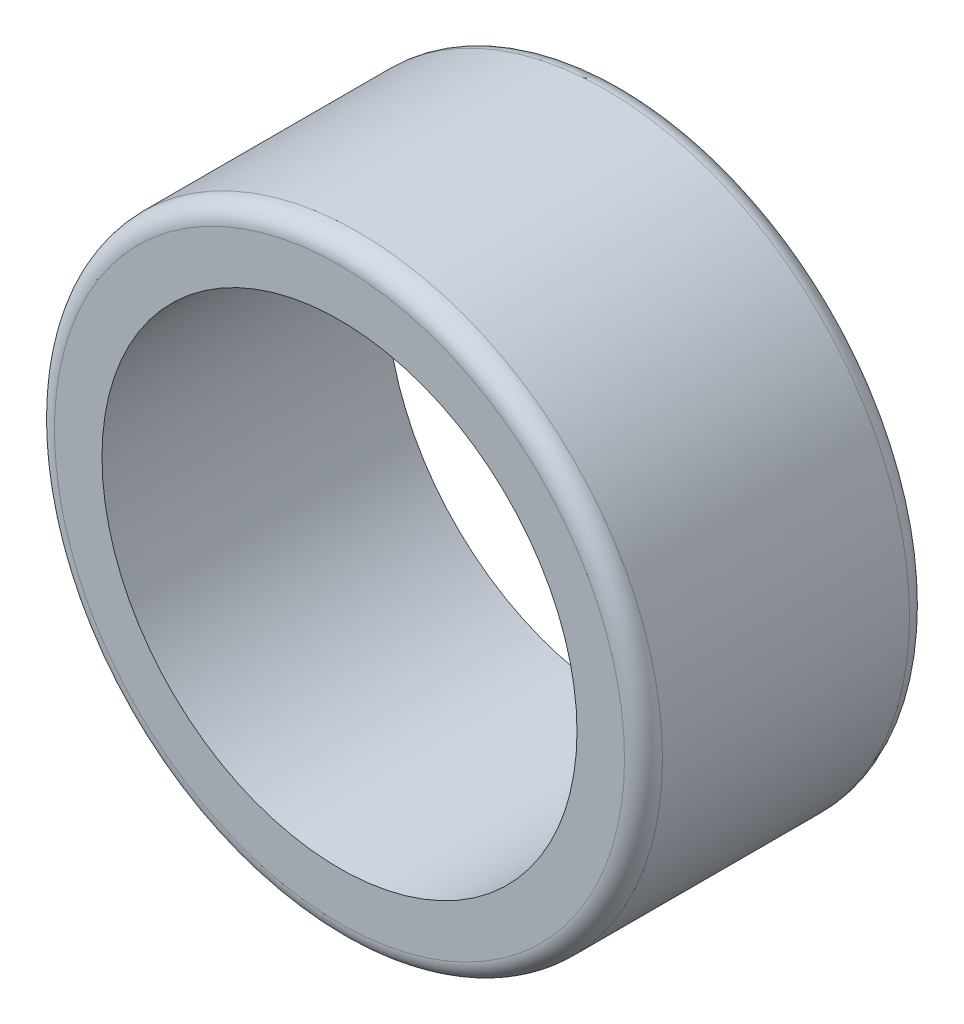
from build123d import *

# Parameters (mm, degrees)
ESQUISSE1_R          = 32
ESQUISSE1_R_2        = 25
BASE_EXTRUSION_DEPTH = 30
CONG_1_R             = 2


with BuildPart() as part:
    # Esquisse1 → Base-Extrusion (new body)
    with BuildSketch(Plane.XY):
        Circle(ESQUISSE1_R)
        Circle(ESQUISSE1_R_2, mode=Mode.SUBTRACT)
    extrude(amount=BASE_EXTRUSION_DEPTH)

    # Congé1
    cong_1_edges = [part.edges().sort_by_distance(p)[0] for p in [
        (-32, 0, 0),
        (-32, 0, 30),
    ]]
    fillet(cong_1_edges, radius=CONG_1_R)


solid = part.part
